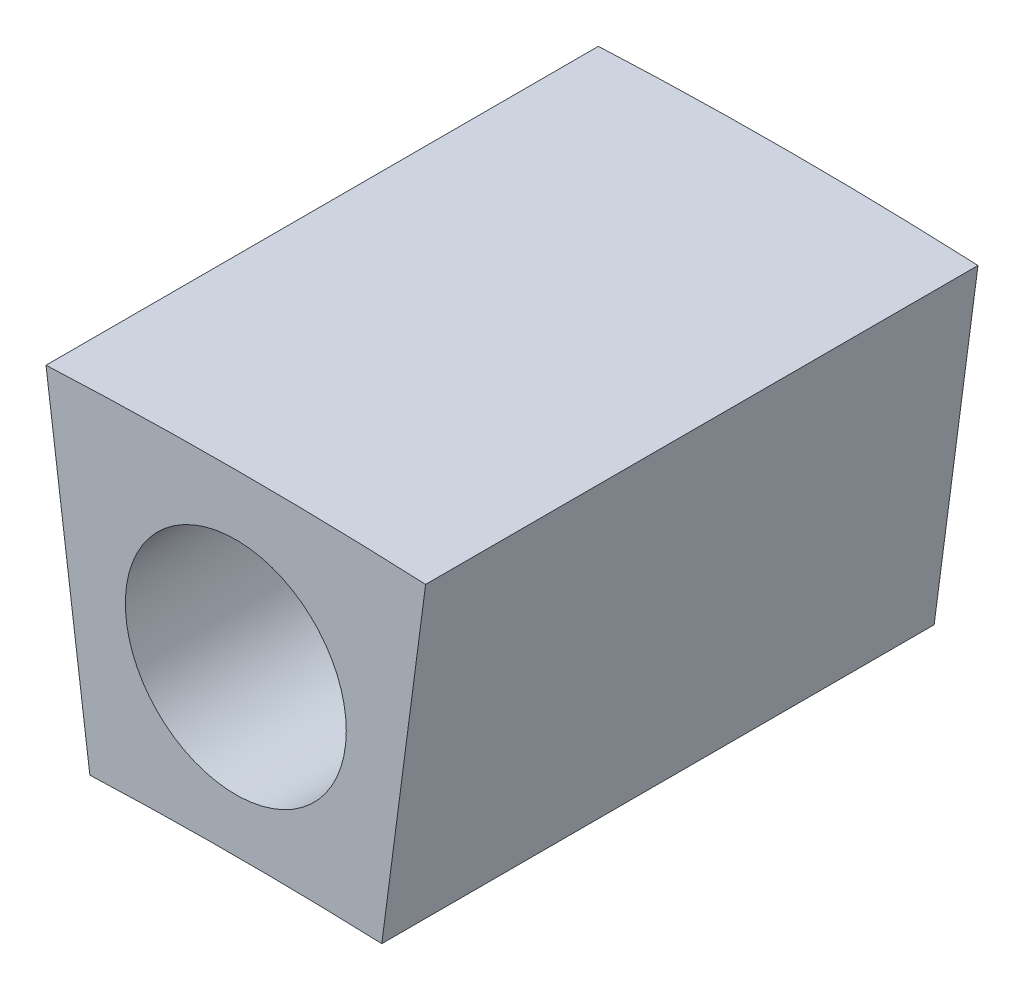
from build123d import *

# Parameters (mm, degrees)
BOSS_EXTRUDE1_DEPTH = 7.5
SKETCH2_R           = 3
CUT_EXTRUDE1_DEPTH  = 15


with BuildPart() as part:
    # Sketch1 → Boss-Extrude1 (new, symmetric)
    with BuildSketch(Plane(origin=(0, 0, 0), x_dir=(-1, 0, 0), z_dir=(0, 0, 1))):
        with BuildLine():
            Line((5.154406377, -5.123005585), (3.963575151, 3.922255592))
            ThreePointArc((3.963575151, 3.922255592), (0, 3.846483961), (-3.963575151, 3.922255592))
            Line((-3.963575151, 3.922255592), (-5.154406377, -5.123005585))
            ThreePointArc((-5.154406377, -5.123005585), (0, -5.241098686), (5.154406377, -5.123005585))
        make_face()
    extrude(amount=BOSS_EXTRUDE1_DEPTH, both=True)

    # Sketch2 → Cut-Extrude1 (cut)
    with BuildSketch(Plane.XY.offset(7.5)):
        with Locations((0, 0.600374996)):
            Circle(SKETCH2_R)
    extrude(amount=-CUT_EXTRUDE1_DEPTH, mode=Mode.SUBTRACT)


solid = part.part
